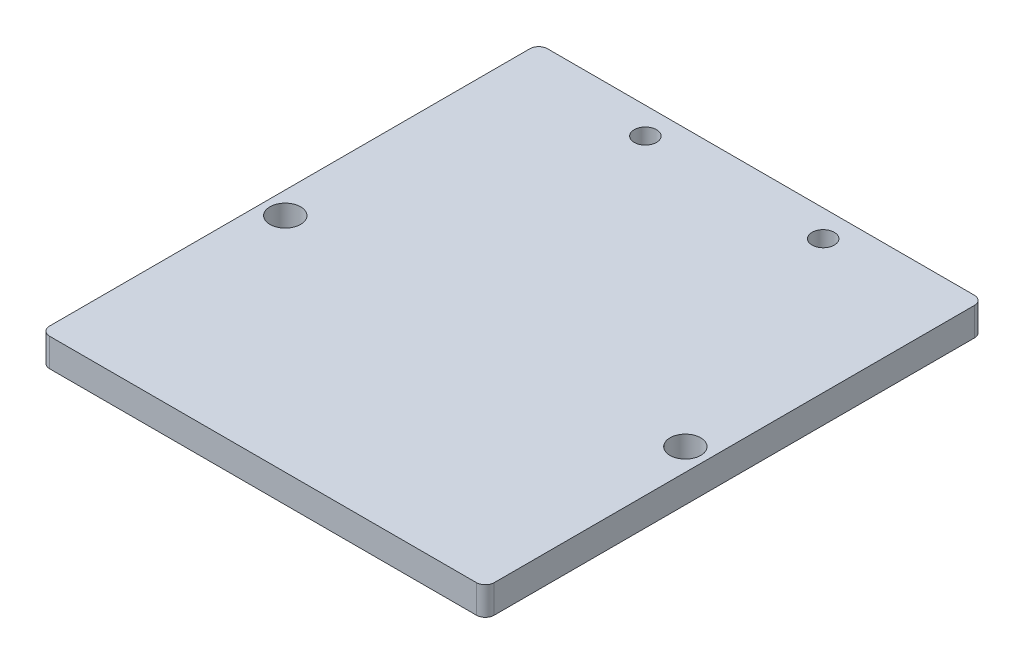
from build123d import *

# Parameters (mm, degrees)
SKETCH1_W               = 50
SKETCH1_H               = 56
SKETCH1_R               = 1.1
BOSS_EXTRUDE1_DEPTH     = 3.175
FILLET1_R               = 1
M3X0_5_TAPPED_HOLE1_D   = 2.5
CUT_EXTRUDE1_DEPTH      = 76.140406074
CUT_EXTRUDE1_DEPTH_BACK = 76.140406074
SKETCH3_R               = 1.725


with BuildPart() as part:
    # Sketch1 → Boss-Extrude1 (new body)
    with BuildSketch(Plane(origin=(0, 0, 0), x_dir=(1, 0, 0), z_dir=(0, 1, 0))):
        with Locations((25, -28)):
            Rectangle(SKETCH1_W, SKETCH1_H)
        with Locations(Location((15, -3, 0), (0, 0, 270))):
            Circle(SKETCH1_R, mode=Mode.SUBTRACT)
        with Locations(Location((35, -3, 0), (0, 0, 270))):
            Circle(SKETCH1_R, mode=Mode.SUBTRACT)
    extrude(amount=BOSS_EXTRUDE1_DEPTH)

    # Fillet1
    fillet1_edges = [part.edges().sort_by_distance(p)[0] for p in [
        (0, 1.5875, 0),
        (50, 1.5875, 0),
        (50, 1.5875, 56),
        (0, 1.5875, 56),
    ]]
    fillet(fillet1_edges, radius=FILLET1_R)

    # M3x0.5 Tapped Hole1 (through all)
    with Locations(Plane(origin=(15, 3.175, 3), x_dir=(0, 0, 1), z_dir=(0, 1, 0))):
        with Locations((0, 0), (0, 20)):
            Hole(M3X0_5_TAPPED_HOLE1_D / 2)

    # Sketch3 → Cut-Extrude1 (cut, two sides: drawn at the far end of the back side and taken through both)
    with BuildSketch(Plane(origin=(0, 3.175, 0), x_dir=(1, 0, 0), z_dir=(0, 1, 0)).offset(-CUT_EXTRUDE1_DEPTH_BACK)):
        with Locations(Location((2.5, -31, 0), (0, 0, 270))):
            Circle(SKETCH3_R)
        with Locations(Location((47.5, -31, 0), (0, 0, 270))):
            Circle(SKETCH3_R)
    extrude(amount=CUT_EXTRUDE1_DEPTH + CUT_EXTRUDE1_DEPTH_BACK, mode=Mode.SUBTRACT)


solid = part.part
